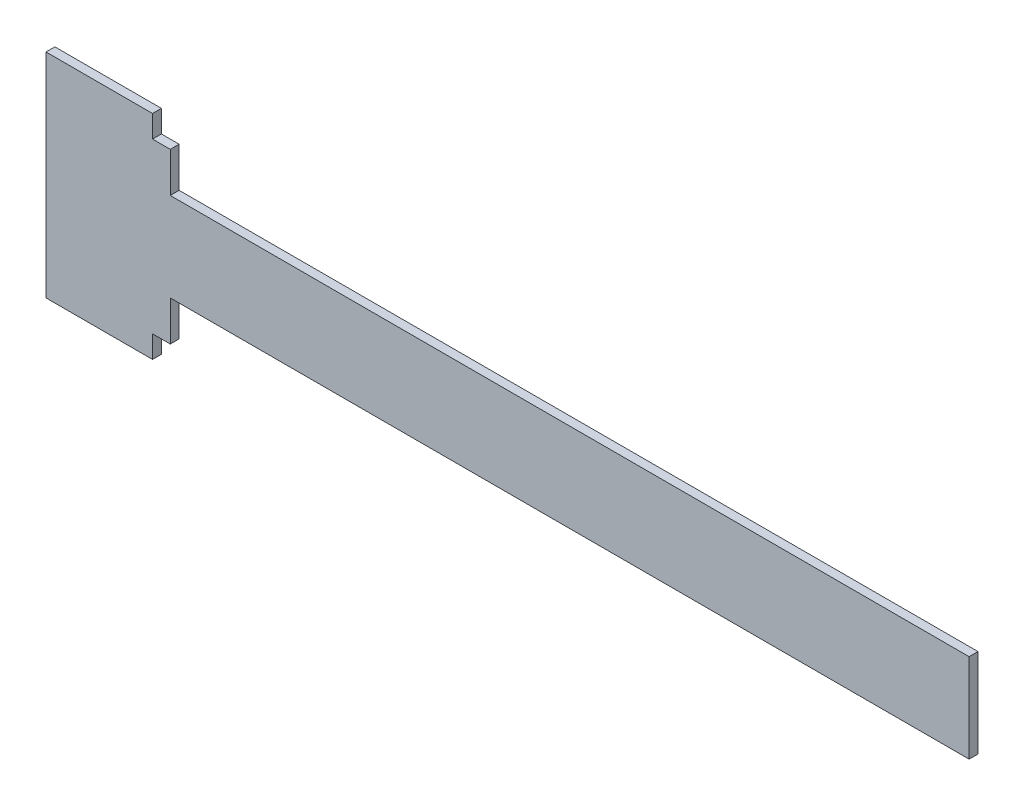
from build123d import *

# Parameters (mm, degrees)
EXTRUDE_1_DEPTH = 1


with BuildPart() as part:
    # 草图1 → 凸台-拉伸1 (new body)
    with BuildSketch(Plane.XY):
        Polygon((-68.976121457, 1.522435897), (-68.976121457, -0.977564103), (-80.976121457, -0.977564103), (-80.976121457, 23.022435897), (-68.976121457, 23.022435897), (-68.976121457, 20.522435897), (-66.976121457, 20.522435897), (-66.976121457, 16.022435897), (23.023878543, 16.022435897), (23.023878543, 6.022435897), (-66.976121457, 6.022435897), (-66.976121457, 1.522435897), align=None)
    extrude(amount=EXTRUDE_1_DEPTH)


solid = part.part
